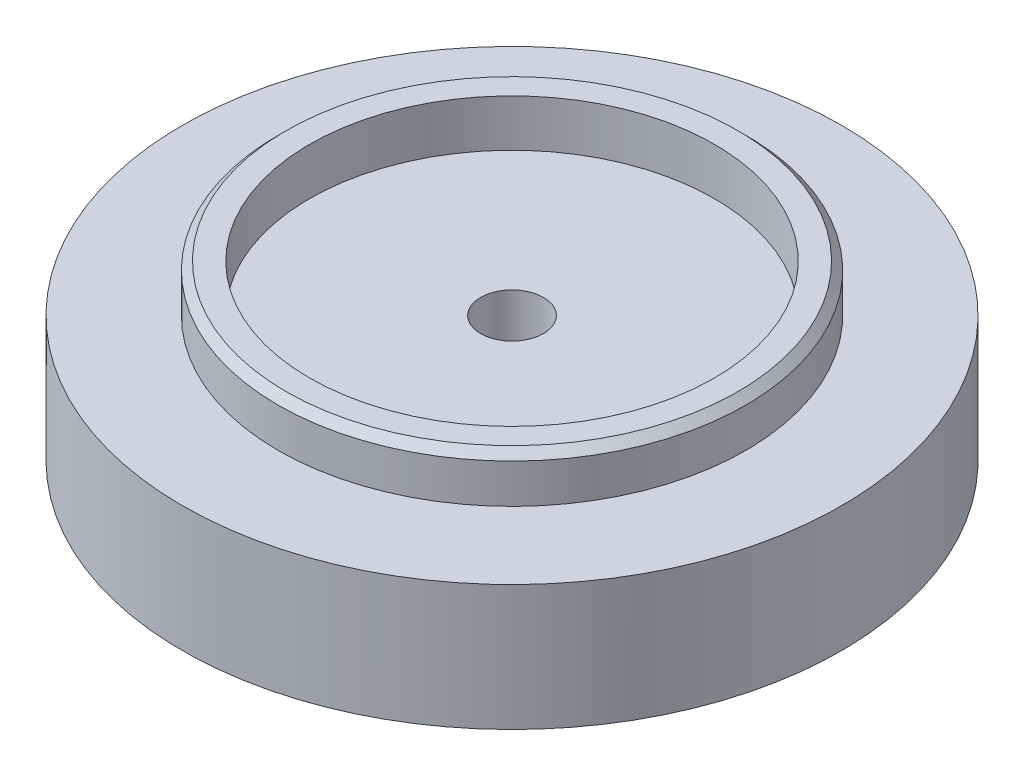
from build123d import *

# Parameters (mm, degrees)
SKETCH1_R           = 21
SKETCH1_R_2         = 2
BOSS_EXTRUDE1_DEPTH = 4
SKETCH2_R           = 14.9
SKETCH2_R_2         = 12.9
BOSS_EXTRUDE2_DEPTH = 3
CHAMFER1_SIZE       = 0.5
BOSS_EXTRUDE3_START = 4
SKETCH3_R           = 21
SKETCH3_R_2         = 2.65
BOSS_EXTRUDE3_DEPTH = 4
BOSS_EXTRUDE4_START = 2
SKETCH4_R           = 2.65
SKETCH4_R_2         = 2
BOSS_EXTRUDE4_DEPTH = 2
CHAMFER2_SIZE       = 0.5


with BuildPart() as part:
    # Sketch1 → Boss-Extrude1 (new body)
    with BuildSketch(Plane(origin=(0, 0, 0), x_dir=(1, 0, 0), z_dir=(0, 1, 0))):
        with Locations(Location((0, 0, 0), (0, 0, 270))):
            Circle(SKETCH1_R)
        with Locations(Location((0, 0, 0), (0, 0, 270))):
            Circle(SKETCH1_R_2, mode=Mode.SUBTRACT)
    extrude(amount=BOSS_EXTRUDE1_DEPTH)

    # Sketch2 → Boss-Extrude2 (add)
    with BuildSketch(Plane(origin=(0, 4, 0), x_dir=(1, 0, 0), z_dir=(0, 1, 0))):
        with Locations(Location((0, 0, 0), (0, 0, 270))):
            Circle(SKETCH2_R)
        with Locations(Location((0, 0, 0), (0, 0, 270))):
            Circle(SKETCH2_R_2, mode=Mode.SUBTRACT)
    extrude(amount=BOSS_EXTRUDE2_DEPTH)

    # Chamfer1
    chamfer1_edges = [part.edges().sort_by_distance(p)[0] for p in [
        (0, 7, -14.9),
    ]]
    chamfer(chamfer1_edges, length=CHAMFER1_SIZE)

    # Sketch3 → Boss-Extrude3 (add)
    with BuildSketch(Plane.XZ.offset(BOSS_EXTRUDE3_START)):
        with Locations(Location((0, 0, 0), (0, 0, 270))):
            Circle(SKETCH3_R)
        with Locations(Location((0, 0, 0), (0, 0, 270))):
            Circle(SKETCH3_R_2, mode=Mode.SUBTRACT)
    extrude(amount=-BOSS_EXTRUDE3_DEPTH)

    # Sketch4 → Boss-Extrude4 (add)
    with BuildSketch(Plane.XZ.offset(BOSS_EXTRUDE4_START)):
        with Locations(Location((0, 0, 0), (0, 0, 270))):
            Circle(SKETCH4_R)
        with Locations(Location((0, 0, 0), (0, 0, 270))):
            Circle(SKETCH4_R_2, mode=Mode.SUBTRACT)
    extrude(amount=-BOSS_EXTRUDE4_DEPTH)

    # Chamfer2
    chamfer2_edges = [part.edges().sort_by_distance(p)[0] for p in [
        (0, -4, 2.65),
    ]]
    chamfer(chamfer2_edges, length=CHAMFER2_SIZE)


solid = part.part
